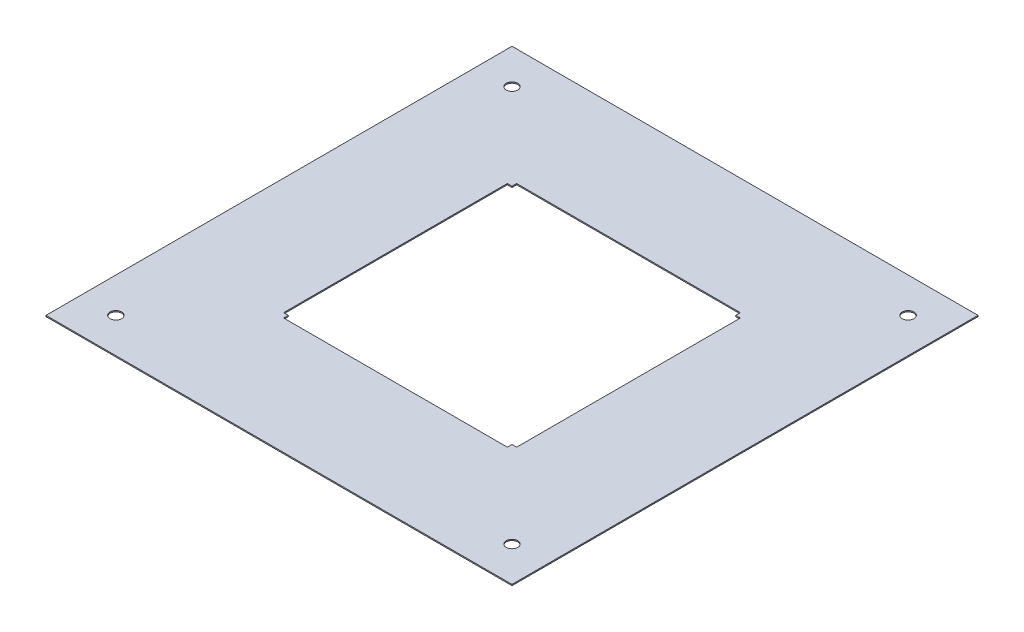
from build123d import *

# Parameters (mm, degrees)
CROQUIS1_W              = 200
CROQUIS1_H              = 200
CROQUIS1_R              = 2.5
SALIENTE_EXTRUIR1_DEPTH = 0.5
CORTAR_EXTRUIR1_DEPTH   = 10


with BuildPart() as part:
    # Croquis1 → Saliente-Extruir1 (new body)
    with BuildSketch(Plane(origin=(0, 0, 0), x_dir=(1, 0, 0), z_dir=(0, 1, 0))):
        with Locations((100, 100)):
            Rectangle(CROQUIS1_W, CROQUIS1_H)
        with Locations(Location((15, 185, 0), (0, 0, 270))):
            Circle(CROQUIS1_R, mode=Mode.SUBTRACT)
        with Locations(Location((185, 185, 0), (0, 0, 270))):
            Circle(CROQUIS1_R, mode=Mode.SUBTRACT)
        with Locations(Location((185, 15, 0), (0, 0, 270))):
            Circle(CROQUIS1_R, mode=Mode.SUBTRACT)
        with Locations(Location((15, 15, 0), (0, 0, 270))):
            Circle(CROQUIS1_R, mode=Mode.SUBTRACT)
    extrude(amount=SALIENTE_EXTRUIR1_DEPTH)

    # Croquis2 → Cortar-Extruir1 (cut)
    with BuildSketch(Plane(origin=(0, 0.5, 0), x_dir=(1, 0, 0), z_dir=(0, 1, 0))):
        Polygon((50, 148), (50, 100), (50, 52), (52, 52), (52, 50), (100, 50), (148, 50), (148, 52), (150, 52), (150, 100), (150, 148), (148, 148), (148, 150), (100, 150), (52, 150), (52, 148), align=None)
    extrude(amount=-CORTAR_EXTRUIR1_DEPTH, mode=Mode.SUBTRACT)


solid = part.part
